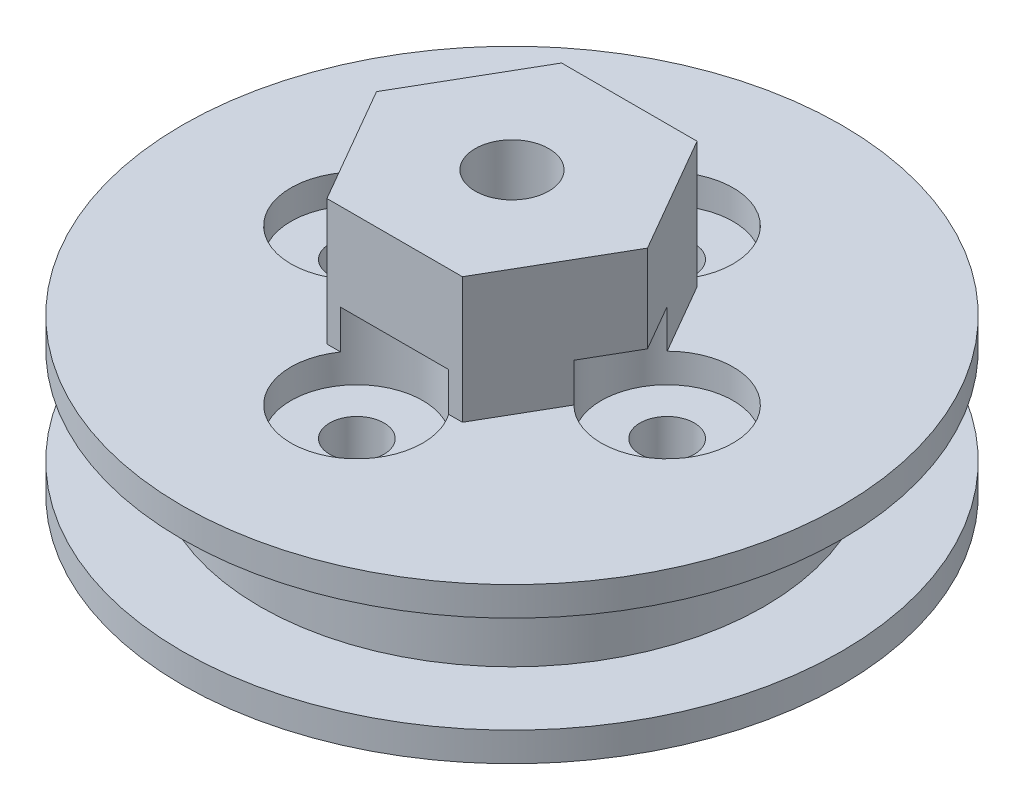
from build123d import *
from build123d.topology import SkipClean

# Parameters (mm, degrees)
SKETCH_1_R          = 17
SKETCH_1_R_2        = 1.4
SKETCH_1_R_3        = 4.3
EXTRUDE_1_DEPTH     = 8
CUT_EXTRUDE_START   = -1.5
SKETCH_5_R          = 3.4
SKETCH_5_R_2        = 1.4
CUT_EXTRUDE_1_DEPTH = 1.5
SKETCH_7_R          = 1.9
EXTRUDE_5_DEPTH     = 6.5
CUT_EXTRUDE_2_DEPTH = 2
SKETCH_9_W          = 4
SKETCH_9_H          = 5


with BuildPart() as part:
    # 草图1 → 凸台-拉伸1 (new body)
    with BuildSketch(Plane(origin=(0, 0, 0), x_dir=(1, 0, 0), z_dir=(0, 1, 0))):
        with Locations(Location((0, 0, 0), (0, 0, 270))):
            Circle(SKETCH_1_R)
        with Locations(Location((0, 8, 0), (0, 0, 270))):
            Circle(SKETCH_1_R_2, mode=Mode.SUBTRACT)
        with Locations(Location((8, 0, 0), (0, 0, 270))):
            Circle(SKETCH_1_R_2, mode=Mode.SUBTRACT)
        with Locations(Location((0, -8, 0), (0, 0, 270))):
            Circle(SKETCH_1_R_2, mode=Mode.SUBTRACT)
        with Locations(Location((-8, 0, 0), (0, 0, 270))):
            Circle(SKETCH_1_R_2, mode=Mode.SUBTRACT)
        with Locations(Location((0, 0, 0), (0, 0, 270))):
            Circle(SKETCH_1_R_3, mode=Mode.SUBTRACT)
    extrude(amount=EXTRUDE_1_DEPTH)

    # 草图5 → 切除-拉伸1 (cut)
    # profile 1 of 4: a face of its own
    with BuildSketch(Plane(origin=(0, 8, 0), x_dir=(1, 0, 0), z_dir=(0, 1, 0)).offset(CUT_EXTRUDE_START)):
        with Locations(Location((0, -8, 0), (0, 0, 270))):
            Circle(SKETCH_5_R)
        with Locations(Location((0, -8, 0), (0, 0, 270))):
            Circle(SKETCH_5_R_2, mode=Mode.SUBTRACT)
    # profile 2 of 4: a face of its own
    with BuildSketch(Plane(origin=(0, 8, 0), x_dir=(1, 0, 0), z_dir=(0, 1, 0)).offset(CUT_EXTRUDE_START)):
        with Locations(Location((8, 0, 0), (0, 0, 270))):
            Circle(SKETCH_5_R)
        with Locations(Location((8, 0, 0), (0, 0, 270))):
            Circle(SKETCH_5_R_2, mode=Mode.SUBTRACT)
    # profile 3 of 4: a face of its own
    with BuildSketch(Plane(origin=(0, 8, 0), x_dir=(1, 0, 0), z_dir=(0, 1, 0)).offset(CUT_EXTRUDE_START)):
        with Locations(Location((-8, 0, 0), (0, 0, 270))):
            Circle(SKETCH_5_R)
        with Locations(Location((-8, 0, 0), (0, 0, 270))):
            Circle(SKETCH_5_R_2, mode=Mode.SUBTRACT)
    # profile 4 of 4: a face of its own
    with BuildSketch(Plane(origin=(0, 8, 0), x_dir=(1, 0, 0), z_dir=(0, 1, 0)).offset(CUT_EXTRUDE_START)):
        with Locations(Location((0, 8, 0), (0, 0, 270))):
            Circle(SKETCH_5_R)
        with Locations(Location((0, 8, 0), (0, 0, 270))):
            Circle(SKETCH_5_R_2, mode=Mode.SUBTRACT)
    extrude(amount=CUT_EXTRUDE_1_DEPTH, mode=Mode.SUBTRACT)

    # 草图7 → 凸台-拉伸5 (add)
    with BuildSketch(Plane(origin=(0, 8, 0), x_dir=(1, 0, 0), z_dir=(0, 1, 0))):
        Polygon((3.492969129, -6.05), (6.985938257, 0), (3.492969129, 6.05), (-3.492969129, 6.05), (-6.985938257, 0), (-3.492969129, -6.05), align=None)
        with Locations(Location((0, 0, 0), (0, 0, 90))):
            Circle(SKETCH_7_R, mode=Mode.SUBTRACT)
    extrude(amount=EXTRUDE_5_DEPTH)

    # 草图8 → 切除-拉伸2 (cut)
    with SkipClean():  # the faces are left unmerged after this step: merging them gives an invalid solid
        with BuildSketch(Plane.XZ.offset(-8)):
            with BuildLine():
                Line((-2.785228895, -6.05), (2.785228895, -6.05))
                ThreePointArc((2.785228895, -6.05), (0, -4.6), (-2.785228895, -6.05))
            make_face()
            with BuildLine():
                Line((5.597141368, -2.405466773), (6.985938257, 0))
                Line((6.985938257, 0), (5.597141368, 2.405466773))
                ThreePointArc((5.597141368, 2.405466773), (4.6, 0), (5.597141368, -2.405466773))
            make_face()
            with BuildLine():
                Line((-5.597141368, 2.405466773), (-6.985938257, 0))
                Line((-6.985938257, 0), (-5.597141368, -2.405466773))
                ThreePointArc((-5.597141368, -2.405466773), (-4.6, 0), (-5.597141368, 2.405466773))
            make_face()
            with BuildLine():
                Line((2.785228895, 6.05), (-2.785228895, 6.05))
                ThreePointArc((-2.785228895, 6.05), (0, 4.6), (2.785228895, 6.05))
            make_face()
        extrude(amount=-CUT_EXTRUDE_2_DEPTH, mode=Mode.SUBTRACT)

    # 草图9 → 切除-旋转4 (revolve, cut)
    with SkipClean():  # the faces are left unmerged after this step: merging them gives an invalid solid
        with BuildSketch(Plane(origin=(0, 0, 0), x_dir=(0, 0, -1), z_dir=(1, 0, 0))):
            with Locations((-15, 4)):
                Rectangle(SKETCH_9_W, SKETCH_9_H)
        revolve(axis=Axis((0, 18.709489751, 0), (0, -1, 0)), mode=Mode.SUBTRACT)


solid = part.part
